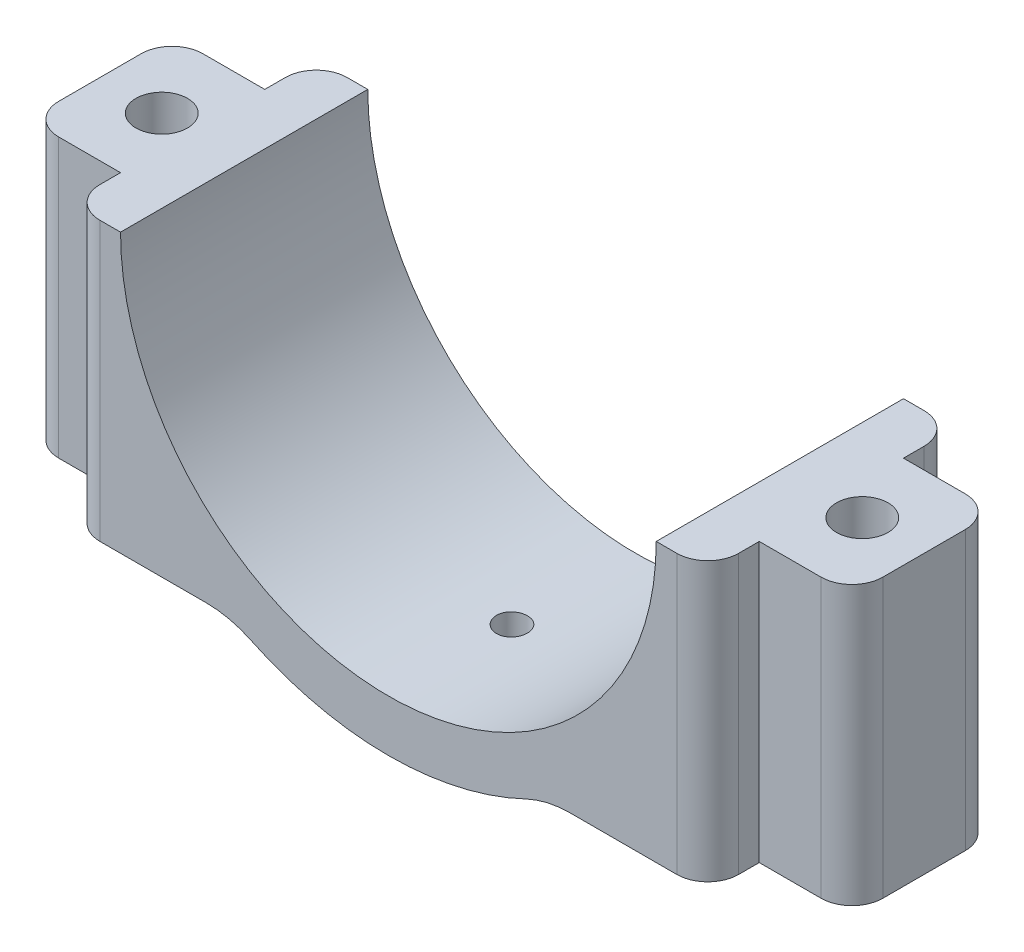
from build123d import *

# Parameters (mm, degrees)
SKETCH_1_W               = 80
SKETCH_1_H               = 24
EXTRUDE_1_DEPTH          = 27
EXTRUDE_3_DEPTH          = 24
CUT_EXTRUDE_1_DEPTH      = 54.898051913
CUT_EXTRUDE_3_DEPTH      = 50.729267037
CUT_EXTRUDE_3_DEPTH_BACK = 50.729267037
SKETCH_4_R               = 1.5
CUT_EXTRUDE_4_DEPTH      = 50.729267115
CUT_EXTRUDE_4_DEPTH_BACK = 50.729267115
SKETCH_5_W               = 9
SKETCH_5_H               = 5
SKETCH_6_W               = 9
SKETCH_6_H               = 5
CUT_EXTRUDE_7_DEPTH      = 50.729267115
SKETCH_7_W               = 9
SKETCH_7_H               = 5
CUT_EXTRUDE_8_DEPTH      = 50.729267115
SKETCH_8_W               = 9
SKETCH_8_H               = 5
CUT_EXTRUDE_9_DEPTH      = 50.729267115
SKETCH_9_R               = 2.5
CUT_EXTRUDE_12_DEPTH     = 50.729267115
SKETCH_11_R              = 2.5
CUT_EXTRUDE_13_DEPTH     = 50.729267115
FILLET_1_R               = 3
FILLET_2_R               = 10


with BuildPart() as part:
    # 草图1 → 凸台-拉伸1 (new body)
    with BuildSketch(Plane(origin=(0, 0, 0), x_dir=(1, 0, 0), z_dir=(0, 1, 0))):
        Rectangle(SKETCH_1_W, SKETCH_1_H)
    extrude(amount=EXTRUDE_1_DEPTH)

    # 草图2 → 凸台-拉伸3 (add, through all)
    with BuildSketch(Plane.XY.offset(12)):
        with BuildLine():
            Line((-31, 27), (31, 27))
            ThreePointArc((31, 27), (0, -4), (-31, 27))
        make_face()
    extrude(amount=-EXTRUDE_3_DEPTH)

    # 草图3 → 切除-拉伸1 (cut, through all)
    with BuildSketch(Plane.XY.offset(12)):
        with BuildLine():
            Line((-26, 27), (26, 27))
            ThreePointArc((26, 27), (0, 1), (-26, 27))
        make_face()
    extrude(amount=-CUT_EXTRUDE_1_DEPTH, mode=Mode.SUBTRACT)

    # 草图4 → 切除-拉伸3 (cut, two sides: drawn at the far end of the back side and taken through both)
    with BuildSketch(Plane(origin=(0, 0, 0), x_dir=(1, 0, 0), z_dir=(0, 1, 0)).offset(-CUT_EXTRUDE_3_DEPTH_BACK)):
        with Locations(Location((0, 0, 0), (0, 0, 270))):
            Circle(SKETCH_4_R)
    extrude(amount=CUT_EXTRUDE_3_DEPTH + CUT_EXTRUDE_3_DEPTH_BACK, mode=Mode.SUBTRACT)

    # 草图5 → 切除-拉伸4 (cut, two sides: drawn at the far end of the back side and taken through both)
    with BuildSketch(Plane(origin=(0, 0, 0), x_dir=(1, 0, 0), z_dir=(0, 1, 0)).offset(-CUT_EXTRUDE_4_DEPTH_BACK)):
        with Locations((-35.5, 9.5)):
            Rectangle(SKETCH_5_W, SKETCH_5_H)
    extrude(amount=CUT_EXTRUDE_4_DEPTH + CUT_EXTRUDE_4_DEPTH_BACK, mode=Mode.SUBTRACT)

    # 草图6 → 切除-拉伸7 (cut, through all)
    with BuildSketch(Plane(origin=(0, 0, 0), x_dir=(1, 0, 0), z_dir=(0, 1, 0))):
        with Locations((-35.5, -9.5)):
            Rectangle(SKETCH_6_W, SKETCH_6_H)
    extrude(amount=CUT_EXTRUDE_7_DEPTH, mode=Mode.SUBTRACT)

    # 草图7 → 切除-拉伸8 (cut, through all)
    with BuildSketch(Plane(origin=(0, 0, 0), x_dir=(1, 0, 0), z_dir=(0, 1, 0))):
        with Locations((35.5, 9.5)):
            Rectangle(SKETCH_7_W, SKETCH_7_H)
    extrude(amount=CUT_EXTRUDE_8_DEPTH, mode=Mode.SUBTRACT)

    # 草图8 → 切除-拉伸9 (cut, through all)
    with BuildSketch(Plane(origin=(0, 0, 0), x_dir=(1, 0, 0), z_dir=(0, 1, 0))):
        with Locations((35.5, -9.5)):
            Rectangle(SKETCH_8_W, SKETCH_8_H)
    extrude(amount=CUT_EXTRUDE_9_DEPTH, mode=Mode.SUBTRACT)

    # 草图9 → 切除-拉伸12 (cut, through all)
    with BuildSketch(Plane(origin=(0, 0, 0), x_dir=(1, 0, 0), z_dir=(0, 1, 0))):
        with Locations(Location((-34, 0, 0), (0, 0, 270))):
            Circle(SKETCH_9_R)
    extrude(amount=CUT_EXTRUDE_12_DEPTH, mode=Mode.SUBTRACT)

    # 草图11 → 切除-拉伸13 (cut, through all)
    with BuildSketch(Plane(origin=(0, 0, 0), x_dir=(1, 0, 0), z_dir=(0, 1, 0))):
        with Locations(Location((34, 0, 0), (0, 0, 270))):
            Circle(SKETCH_11_R)
    extrude(amount=CUT_EXTRUDE_13_DEPTH, mode=Mode.SUBTRACT)

    # 圆角1
    fillet_1_edges = [part.edges().sort_by_distance(p)[0] for p in [
        (40, 13.5, 7),
        (31, 13.5, 12),
        (-40, 13.5, -7),
        (-31, 13.5, -12),
        (-40, 13.5, 7),
        (-31, 13.5, 12),
        (40, 13.5, -7),
        (31, 13.5, -12),
    ]]
    fillet(fillet_1_edges, radius=FILLET_1_R)

    # 圆角2
    fillet_2_edges = [part.edges().sort_by_distance(p)[0] for p in [
        (-15.231546212, 0, 0),
        (15.231546212, 0, 0),
    ]]
    fillet(fillet_2_edges, radius=FILLET_2_R)


solid = part.part
